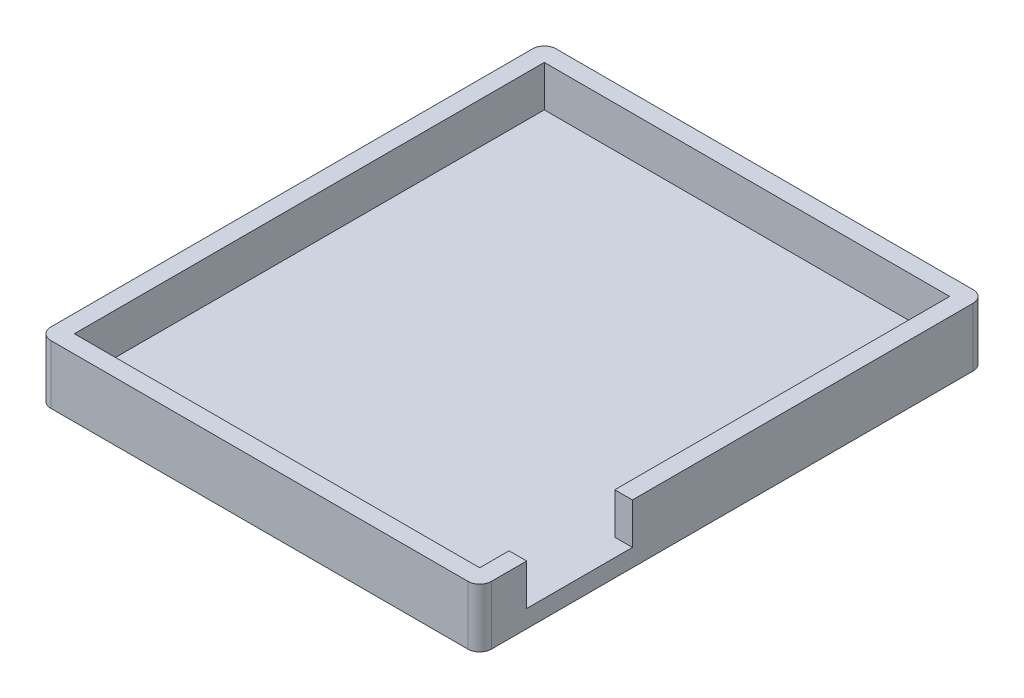
from build123d import *

# Parameters (mm, degrees)
SKETCH1_W           = 75
SKETCH1_H           = 86
BOSS_EXTRUDE1_DEPTH = 3
SKETCH1_4_W         = 75
SKETCH1_4_H         = 86
SKETCH1_4_W_2       = 69
SKETCH1_4_H_2       = 80
BOSS_EXTRUDE2_DEPTH = 10
SKETCH2_W           = 18
SKETCH2_H           = 7
CUT_EXTRUDE1_DEPTH  = 10
FILLET1_R           = 2


with BuildPart() as part:
    # Sketch1 → Boss-Extrude1 (new body)
    with BuildSketch(Plane(origin=(0, 0, 0), x_dir=(1, 0, 0), z_dir=(0, 1, 0))):
        Rectangle(SKETCH1_W, SKETCH1_H)
    extrude(amount=BOSS_EXTRUDE1_DEPTH)

    # Sketch1<4> → Boss-Extrude2 (add)
    with BuildSketch(Plane(origin=(0, 0, 0), x_dir=(1, 0, 0), z_dir=(0, 1, 0))):
        Rectangle(SKETCH1_4_W, SKETCH1_4_H)
        Rectangle(SKETCH1_4_W_2, SKETCH1_4_H_2, mode=Mode.SUBTRACT)
    extrude(amount=BOSS_EXTRUDE2_DEPTH)

    # Sketch2 → Cut-Extrude1 (cut)
    with BuildSketch(Plane(origin=(37.5, 0, 0), x_dir=(0, 0, -1), z_dir=(1, 0, 0))):
        with Locations((-26, 6.5)):
            Rectangle(SKETCH2_W, SKETCH2_H)
    extrude(amount=-CUT_EXTRUDE1_DEPTH, mode=Mode.SUBTRACT)

    # Fillet1
    fillet1_edges = [part.edges().sort_by_distance(p)[0] for p in [
        (-37.5, 5, -43),
        (37.5, 5, -43),
        (37.5, 5, 43),
        (-37.5, 5, 43),
    ]]
    fillet(fillet1_edges, radius=FILLET1_R)


solid = part.part
